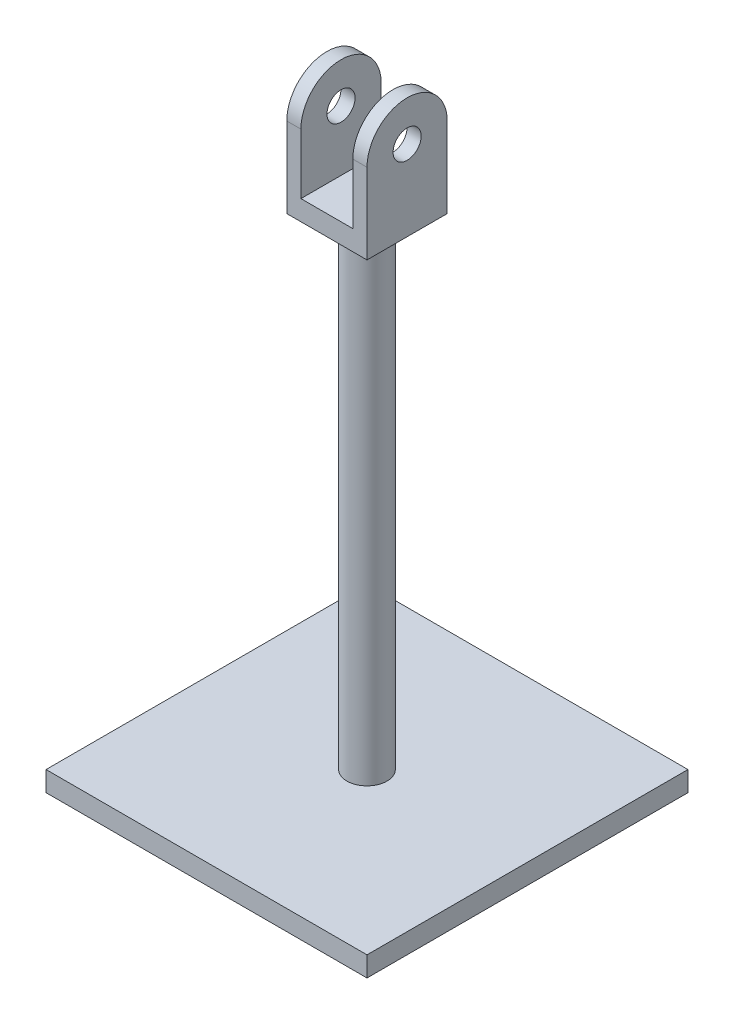
from build123d import *

# Parameters (mm, degrees)
ESBO_O10_W               = 80
ESBO_O10_H               = 80
RESSALTO_EXTRUS_O4_DEPTH = 5
ESBO_O11_R               = 5
RESSALTO_EXTRUS_O5_DEPTH = 120
ESBO_O12_W               = 20
ESBO_O12_H               = 20
RESSALTO_EXTRUS_O6_DEPTH = 5
ESBO_O13_R               = 3.5
RESSALTO_EXTRUS_O7_DEPTH = 10
ESBO_O16_W               = 12.944950436
ESBO_O16_H               = 50
CORTE_EXTRUS_O8_DEPTH    = 20


with BuildPart() as part:
    # Esboço10 → Ressalto-extrusão4 (new body)
    with BuildSketch(Plane(origin=(0, 0, 0), x_dir=(1, 0, 0), z_dir=(0, 1, 0))):
        Rectangle(ESBO_O10_W, ESBO_O10_H)
    extrude(amount=RESSALTO_EXTRUS_O4_DEPTH)

    # Esboço11 → Ressalto-extrusão5 (add)
    with BuildSketch(Plane(origin=(0, 5, 0), x_dir=(1, 0, 0), z_dir=(0, 1, 0))):
        with Locations(Location((0, 0, 0), (0, 0, 270))):
            Circle(ESBO_O11_R)
    extrude(amount=RESSALTO_EXTRUS_O5_DEPTH)

    # Esboço12 → Ressalto-extrusão6 (add)
    with BuildSketch(Plane(origin=(0, 125, 0), x_dir=(1, 0, 0), z_dir=(0, 1, 0))):
        Rectangle(ESBO_O12_W, ESBO_O12_H)
    extrude(amount=RESSALTO_EXTRUS_O6_DEPTH)

    # Esboço13 → Ressalto-extrusão7 (add, symmetric)
    with BuildSketch(Plane(origin=(0, 0, 0), x_dir=(0, 0, -1), z_dir=(1, 0, 0))):
        with BuildLine():
            Line((10, 130), (-10, 130))
            Line((-10, 130), (-10, 145))
            ThreePointArc((-10, 145), (0, 155), (10, 145))
            Line((10, 145), (10, 130))
        make_face()
        with Locations((0, 145)):
            Circle(ESBO_O13_R, mode=Mode.SUBTRACT)
    extrude(amount=RESSALTO_EXTRUS_O7_DEPTH, both=True)

    # Esboço16 → Corte-extrusão8 (cut, symmetric)
    with BuildSketch(Plane.XY):
        with Locations((0, 155)):
            Rectangle(ESBO_O16_W, ESBO_O16_H)
    extrude(amount=CORTE_EXTRUS_O8_DEPTH, both=True, mode=Mode.SUBTRACT)


solid = part.part
